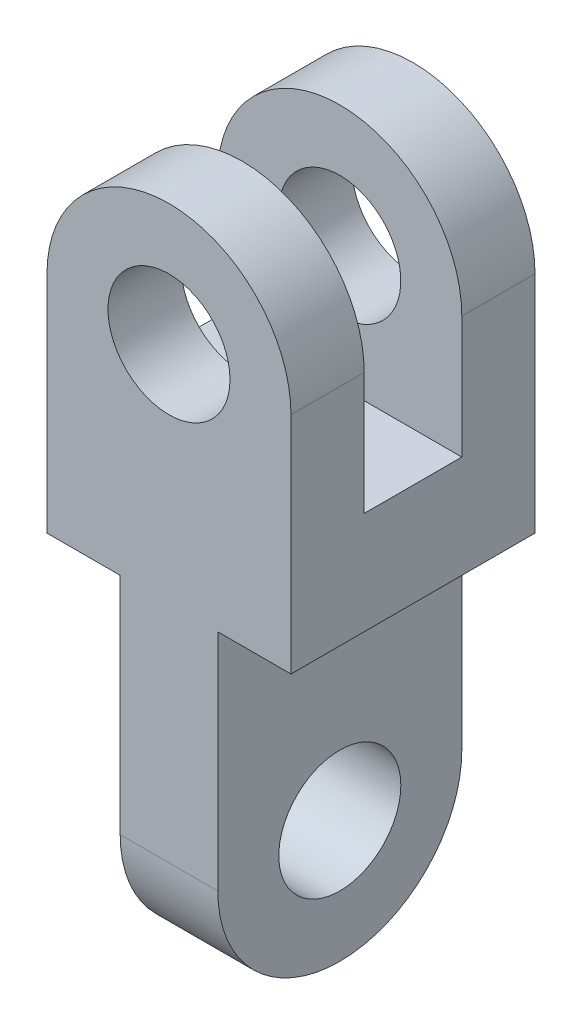
from build123d import *

# Parameters (mm, degrees)
CROQUIS1_R                   = 25
CROQUIS1_W                   = 100
CROQUIS1_H                   = 42
SALIENTE_EXTRUIR1_DEPTH      = 30
CROQUIS4_W                   = 100
CROQUIS4_H                   = 42
SALIENTE_EXTRUIR2_DEPTH      = 40
CROQUIS5_R                   = 25
SALIENTE_EXTRUIR3_DEPTH      = 30
SALIENTE_EXTRUIR4_DEPTH      = 20
SALIENTE_EXTRUIR4_DEPTH_BACK = 20
CROQUIS6_R                   = 25


with BuildPart() as part:
    # Croquis1 → Saliente-Extruir1 (new body)
    # profile 1 of 2: a face of its own
    with BuildSketch(Plane.XY):
        with BuildLine():
            ThreePointArc((50, 0), (0, 50), (-50, 0))
            Line((-50, 0), (-50, -50))
            Line((-50, -50), (50, -50))
            Line((50, -50), (50, 0))
        make_face()
        Circle(CROQUIS1_R, mode=Mode.SUBTRACT)
    # profile 2 of 2: a face of its own
    with BuildSketch(Plane.XY):
        with Locations((0, -71)):
            Rectangle(CROQUIS1_W, CROQUIS1_H)
    extrude(amount=-SALIENTE_EXTRUIR1_DEPTH)

    # Croquis4 → Saliente-Extruir2 (add)
    with BuildSketch(Plane(origin=(0, 0, -30), x_dir=(-1, 0, 0), z_dir=(0, 0, -1))):
        with Locations((0, -71)):
            Rectangle(CROQUIS4_W, CROQUIS4_H)
    extrude(amount=SALIENTE_EXTRUIR2_DEPTH)

    # Croquis5 → Saliente-Extruir3 (add)
    with BuildSketch(Plane(origin=(0, 0, -70), x_dir=(-1, 0, 0), z_dir=(0, 0, -1))):
        with BuildLine():
            Line((-50, 0), (-50, -92))
            Line((-50, -92), (50, -92))
            Line((50, -92), (50, 0))
            ThreePointArc((50, 0), (0, 50), (-50, 0))
        make_face()
        with Locations(Location((0, 0, 0), (0, 0, 180))):
            Circle(CROQUIS5_R, mode=Mode.SUBTRACT)
    extrude(amount=SALIENTE_EXTRUIR3_DEPTH)

    # Croquis6 → Saliente-Extruir4 (add, two sides: drawn at the far end of the back side and taken through both)
    with BuildSketch(Plane(origin=(0, 0, 0), x_dir=(0, 0, -1), z_dir=(1, 0, 0)).offset(-SALIENTE_EXTRUIR4_DEPTH_BACK)):
        with BuildLine():
            Line((0, -184), (0, -92))
            Line((0, -92), (100, -92))
            Line((100, -92), (100, -184))
            ThreePointArc((100, -184), (50, -234), (0, -184))
        make_face()
        with Locations((50, -184)):
            Circle(CROQUIS6_R, mode=Mode.SUBTRACT)
    extrude(amount=SALIENTE_EXTRUIR4_DEPTH + SALIENTE_EXTRUIR4_DEPTH_BACK)


solid = part.part
